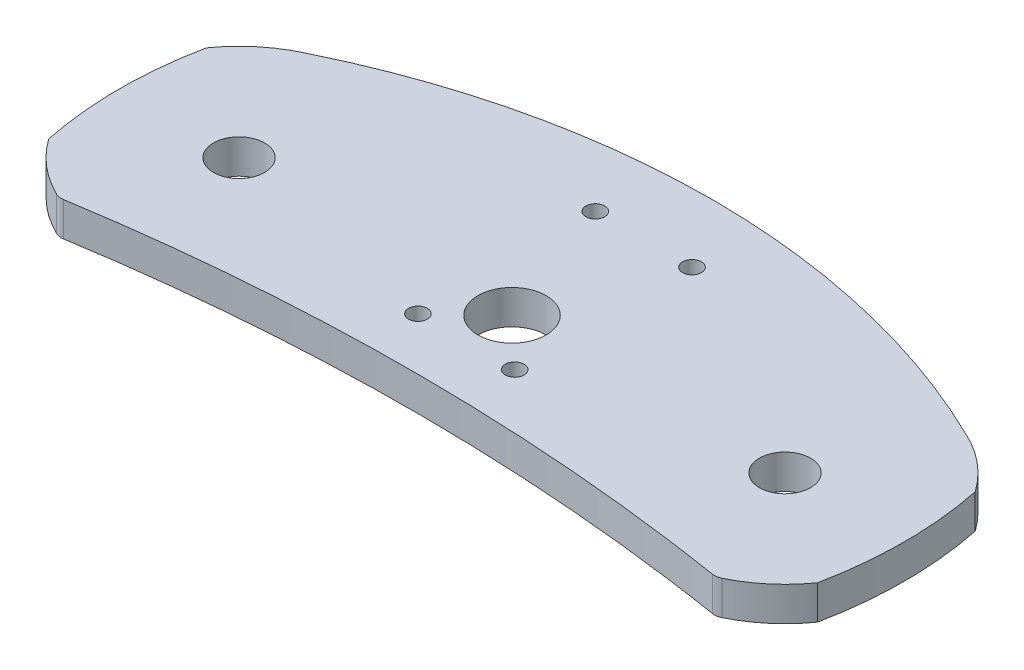
from build123d import *

# Parameters (mm, degrees)
SKETCH1_R           = 73.025
BOSS_EXTRUDE1_DEPTH = 6.35
CUT_EXTRUDE2_START  = -6.35
SKETCH2_R           = 4.7625
SKETCH2_R_2         = 6.35
CUT_EXTRUDE2_DEPTH  = 6.35
SKETCH3_R           = 1.75
SKETCH3_R_2         = 1.5
CUT_EXTRUDE3_DEPTH  = 10
CUT_EXTRUDE7_DEPTH  = 83.240634572
FILLET1_R           = 2.54


with BuildPart() as part:
    # Sketch1 → Boss-Extrude1 (new body)
    with BuildSketch(Plane(origin=(0, 0, 0), x_dir=(1, 0, 0), z_dir=(0, 1, 0))):
        with Locations(Location((0, 0, 0), (0, 0, 270))):
            Circle(SKETCH1_R)
    extrude(amount=BOSS_EXTRUDE1_DEPTH)

    # Sketch2 → Cut-Extrude2 (cut)
    with BuildSketch(Plane(origin=(0, 6.35, 0), x_dir=(1, 0, 0), z_dir=(0, 1, 0)).offset(CUT_EXTRUDE2_START)):
        with BuildLine():
            ThreePointArc((61.150770614, -23.195291499), (0, -37.290063688), (-61.150770614, -23.195291499))
            ThreePointArc((-61.150770614, -23.195291499), (-66.917906968, -19.630921399), (-71.53671875, -14.667941079))
            ThreePointArc((-71.53671875, -14.667941079), (0, -73.025), (71.53671875, -14.667941079))
            ThreePointArc((71.53671875, -14.667941079), (66.917906968, -19.630921399), (61.150770614, -23.195291499))
        make_face()
        with BuildLine():
            ThreePointArc((-61.150770614, 23.195291499), (0, 37.290063688), (61.150770614, 23.195291499))
            ThreePointArc((61.150770614, 23.195291499), (66.917906968, 19.630921399), (71.53671875, 14.667941079))
            ThreePointArc((71.53671875, 14.667941079), (0, 73.025), (-71.53671875, 14.667941079))
            ThreePointArc((-71.53671875, 14.667941079), (-66.917906968, 19.630921399), (-61.150770614, 23.195291499))
        make_face()
        with Locations(Location((-50.8, 0, 0), (0, 0, 270))):
            Circle(SKETCH2_R)
        with Locations(Location((50.8, 0, 0), (0, 0, 270))):
            Circle(SKETCH2_R)
        with Locations(Location((0, 0, 0), (0, 0, 270))):
            Circle(SKETCH2_R_2)
    extrude(amount=CUT_EXTRUDE2_DEPTH, mode=Mode.SUBTRACT)

    # Sketch3 → Cut-Extrude3 (cut)
    # profile 1 of 8: a face of its own
    with BuildSketch(Plane.XZ):
        with Locations(Location((-9, 8.5, 0), (0, 0, 270))):
            Circle(SKETCH3_R)
        with Locations((-9, 8.5)):
            Circle(SKETCH3_R_2, mode=Mode.SUBTRACT)
    # profile 2 of 8: a face of its own
    with BuildSketch(Plane.XZ):
        with Locations((-9, 8.5)):
            Circle(SKETCH3_R_2)
    # profile 3 of 8: a face of its own
    with BuildSketch(Plane.XZ):
        with Locations(Location((-9, -24.5, 0), (0, 0, 270))):
            Circle(SKETCH3_R)
        with Locations((-9, -24.5)):
            Circle(SKETCH3_R_2, mode=Mode.SUBTRACT)
    # profile 4 of 8: a face of its own
    with BuildSketch(Plane.XZ):
        with Locations((-9, -24.5)):
            Circle(SKETCH3_R_2)
    # profile 5 of 8: a face of its own
    with BuildSketch(Plane.XZ):
        with Locations(Location((9, -24.5, 0), (0, 0, 270))):
            Circle(SKETCH3_R)
        with Locations((9, -24.5)):
            Circle(SKETCH3_R_2, mode=Mode.SUBTRACT)
    # profile 6 of 8: a face of its own
    with BuildSketch(Plane.XZ):
        with Locations((9, -24.5)):
            Circle(SKETCH3_R_2)
    # profile 7 of 8: a face of its own
    with BuildSketch(Plane.XZ):
        with Locations(Location((9, 8.5, 0), (0, 0, 270))):
            Circle(SKETCH3_R)
        with Locations((9, 8.5)):
            Circle(SKETCH3_R_2, mode=Mode.SUBTRACT)
    # profile 8 of 8: a face of its own
    with BuildSketch(Plane.XZ):
        with Locations((9, 8.5)):
            Circle(SKETCH3_R_2)
    extrude(amount=-CUT_EXTRUDE3_DEPTH, mode=Mode.SUBTRACT)

    # Sketch5 → Cut-Extrude7 (cut, through all)
    with BuildSketch(Plane(origin=(0, 6.35, 0), x_dir=(1, 0, 0), z_dir=(0, 1, 0))):
        with BuildLine():
            add(Edge.make_bspline(
                [(-61.150770614, -23.195291499), (0, -13.284835877), (61.150770614, -23.195291499)],
                knots=[0, 0, 0, 1, 1, 1], degree=2))
            ThreePointArc((-61.150770614, -23.195291499), (0, -37.290063688), (61.150770614, -23.195291499))
        make_face()
    extrude(amount=-CUT_EXTRUDE7_DEPTH, mode=Mode.SUBTRACT)

    # Fillet1
    fillet1_edges = [part.edges().sort_by_distance(p)[0] for p in [
        (61.150770614, 3.175, 23.195291499),
        (-61.150770614, 3.175, 23.195291499),
    ]]
    fillet(fillet1_edges, radius=FILLET1_R)


solid = part.part
